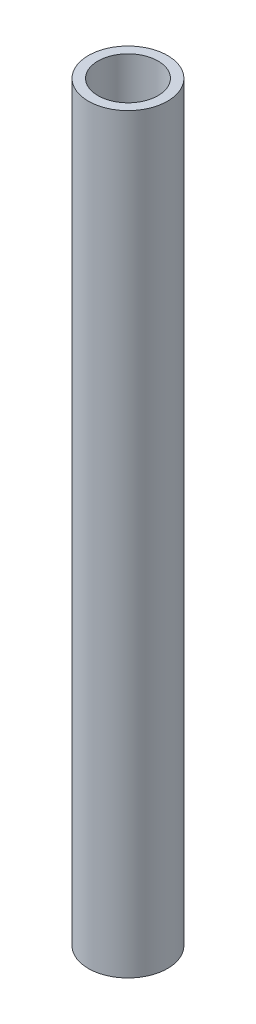
from build123d import *

# Parameters (mm, degrees)
SKETCH1_R           = 1.054
SKETCH1_R_2         = 0.8
BOSS_EXTRUDE1_DEPTH = 20


with BuildPart() as part:
    # Sketch1 → Boss-Extrude1 (new body)
    with BuildSketch(Plane(origin=(0, 0, 0), x_dir=(1, 0, 0), z_dir=(0, 1, 0))):
        with Locations(Location((0, 0, 0), (0, 0, 270))):
            Circle(SKETCH1_R)
        with Locations(Location((0, 0, 0), (0, 0, 270))):
            Circle(SKETCH1_R_2, mode=Mode.SUBTRACT)
    extrude(amount=BOSS_EXTRUDE1_DEPTH)


solid = part.part
